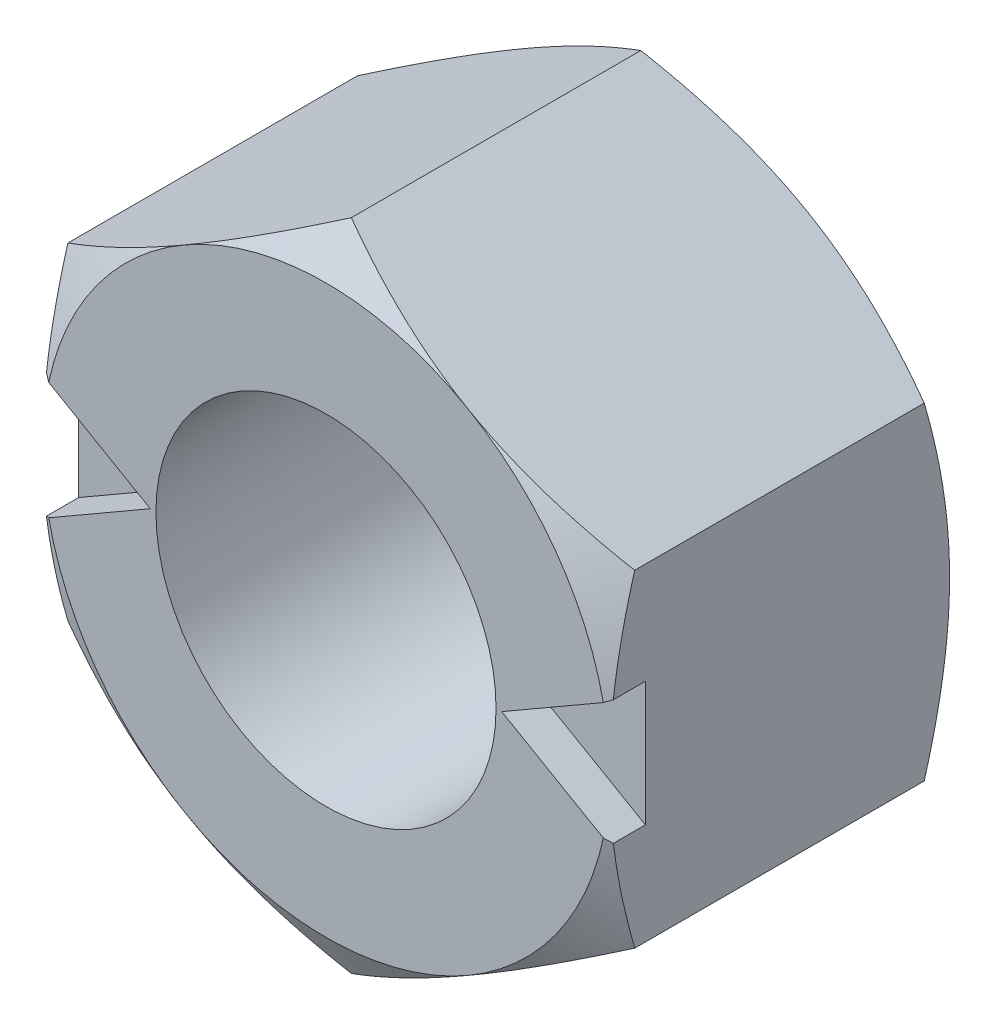
from build123d import *

# Parameters (mm, degrees)
EXTRUDE1_DEPTH      = 3
EXTRUDE1_DEPTH_BACK = 3
SKETCH2_OUTSIDE_W   = 52.392
SKETCH2_OUTSIDE_H   = 53.94
SKETCH2_OUTSIDE_R   = 5
CUT_EXTRUDE1_DEPTH  = 10.712534856
CUT_EXTRUDE1_DRAFT  = 60
SKETCH3_OUTSIDE_W   = 52.392
SKETCH3_OUTSIDE_H   = 53.94
SKETCH3_OUTSIDE_R   = 5
CUT_EXTRUDE2_DEPTH  = 10.712534856
CUT_EXTRUDE2_DRAFT  = 60
SKETCH4_R           = 3
CUT_EXTRUDE3_DEPTH  = 10.712534856
CUT_EXTRUDE7_DEPTH  = 0.635


with BuildPart() as part:
    # Sketch1 → Extrude1 (new, two sides: drawn at the far end of the back side and taken through both)
    with BuildSketch(Plane.XY.offset(-EXTRUDE1_DEPTH_BACK)):
        Polygon((0, 5.773502692), (-5, 2.886751346), (-5, -2.886751346), (0, -5.773502692), (5, -2.886751346), (5, 2.886751346), align=None)
    extrude(amount=EXTRUDE1_DEPTH + EXTRUDE1_DEPTH_BACK)


with BuildPart() as cut_extrude1_tool:
    # Sketch2 outside → Cut-Extrude1 (with draft: the straight prism first)
    with BuildSketch(Plane(origin=(0, 0, 3), x_dir=(-1, 0, 0), z_dir=(0, 0, -1))):
        Rectangle(SKETCH2_OUTSIDE_W, SKETCH2_OUTSIDE_H)
        Circle(SKETCH2_OUTSIDE_R, mode=Mode.SUBTRACT)
    extrude(amount=CUT_EXTRUDE1_DEPTH)
    # Cut-Extrude1: the draft: its side faces are tilted about the plane it starts from
    cut_extrude1_sides = [cut_extrude1_tool.faces().sort_by_distance(p)[0] for p in [
        (0, -26.97, -2.356267428),
        (-26.196, 0, -2.356267428),
        (0, 26.97, -2.356267428),
        (26.196, 0, -2.356267428),
        (5, 0, -2.356267428),
    ]]
    draft(cut_extrude1_sides, Plane(origin=(0, 0, 3), x_dir=(-1, 0, 0), z_dir=(0, 0, -1)), CUT_EXTRUDE1_DRAFT)


with BuildPart() as part_1:
    add(part.part)

    # Cut-Extrude1: cut by cut_extrude1_tool
    add(cut_extrude1_tool.part, mode=Mode.SUBTRACT)


with BuildPart() as cut_extrude2_tool:
    # Sketch3 outside → Cut-Extrude2 (with draft: the straight prism first)
    with BuildSketch(Plane.XY.offset(-3)):
        Rectangle(SKETCH3_OUTSIDE_W, SKETCH3_OUTSIDE_H)
        Circle(SKETCH3_OUTSIDE_R, mode=Mode.SUBTRACT)
    extrude(amount=CUT_EXTRUDE2_DEPTH)
    # Cut-Extrude2: the draft: its side faces are tilted about the plane it starts from
    cut_extrude2_sides = [cut_extrude2_tool.faces().sort_by_distance(p)[0] for p in [
        (0, -26.97, 2.356267428),
        (26.196, 0, 2.356267428),
        (0, 26.97, 2.356267428),
        (-26.196, 0, 2.356267428),
        (-5, 0, 2.356267428),
    ]]
    draft(cut_extrude2_sides, Plane.XY.offset(-3), CUT_EXTRUDE2_DRAFT)


with BuildPart() as part_2:
    add(part_1.part)

    # Cut-Extrude2: cut by cut_extrude2_tool
    add(cut_extrude2_tool.part, mode=Mode.SUBTRACT)

    # Sketch4 → Cut-Extrude3 (cut, through all)
    with BuildSketch(Plane(origin=(0, 0, -3), x_dir=(-1, 0, 0), z_dir=(0, 0, -1))):
        Circle(SKETCH4_R)
    extrude(amount=-CUT_EXTRUDE3_DEPTH, mode=Mode.SUBTRACT)

    # Sketch12 → Cut-Extrude7 (cut)
    with BuildSketch(Plane.XY.offset(3)):
        Polygon((-3.1, 0), (-5, 1.096965511), (-5, -1.096965511), align=None)
        Polygon((3.1, 0), (5, -1.096965511), (5, 1.096965511), align=None)
    extrude(amount=-CUT_EXTRUDE7_DEPTH, mode=Mode.SUBTRACT)


solid = part_2.part
